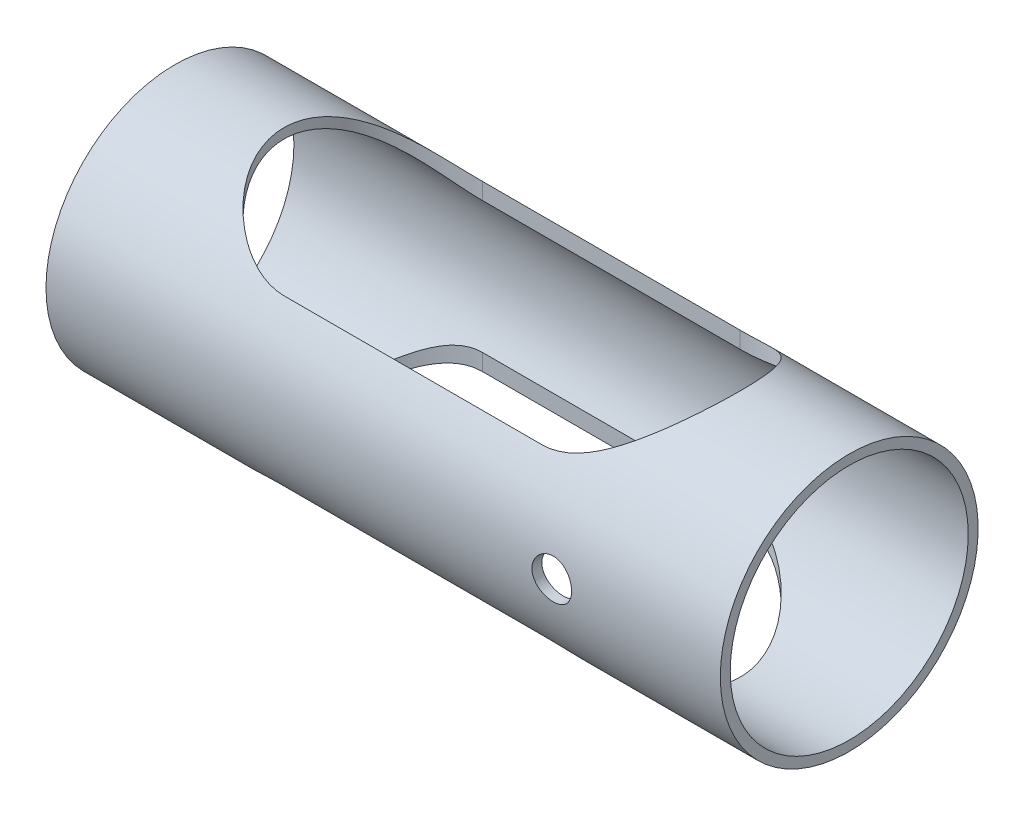
from build123d import *

# Parameters (mm, degrees)
SKETCH1_W               = 68
SKETCH1_H               = 1
CUT_EXTRUDE1_DEPTH      = 39.65229618
CUT_EXTRUDE1_DEPTH_BACK = 39.65229618
SKETCH3_R               = 2
CUT_EXTRUDE2_DEPTH      = 39.652296335


with BuildPart() as part:
    # Sketch1 → Revolve1 (revolve)
    with BuildSketch(Plane.XY, mode=Mode.PRIVATE) as revolve1_sk:
        with Locations((0, 12.5)):
            Rectangle(SKETCH1_W, SKETCH1_H)
    revolve(revolve1_sk.sketch.rotate(Axis((-43.269534002, 0, 0), (1, 0, 0)), 90), axis=Axis((-43.269534002, 0, 0), (1, 0, 0)))

    # Sketch2 → Cut-Extrude1 (cut, two sides: drawn at the far end of the back side and taken through both)
    with BuildSketch(Plane(origin=(0, 0, 0), x_dir=(1, 0, 0), z_dir=(0, 1, 0)).offset(-CUT_EXTRUDE1_DEPTH_BACK)):
        with BuildLine():
            Line((-13, 10), (13, 10))
            ThreePointArc((13, 10), (23, 0), (13, -10))
            Line((13, -10), (-13, -10))
            ThreePointArc((-13, -10), (-23, 0), (-13, 10))
        make_face()
    extrude(amount=CUT_EXTRUDE1_DEPTH + CUT_EXTRUDE1_DEPTH_BACK, mode=Mode.SUBTRACT)

    # Sketch3 → Cut-Extrude2 (cut, through all)
    with BuildSketch(Plane.XY):
        with Locations(Location((17, 0, 0), (0, 0, 180))):
            Circle(SKETCH3_R)
    extrude(amount=CUT_EXTRUDE2_DEPTH, mode=Mode.SUBTRACT)


solid = part.part
